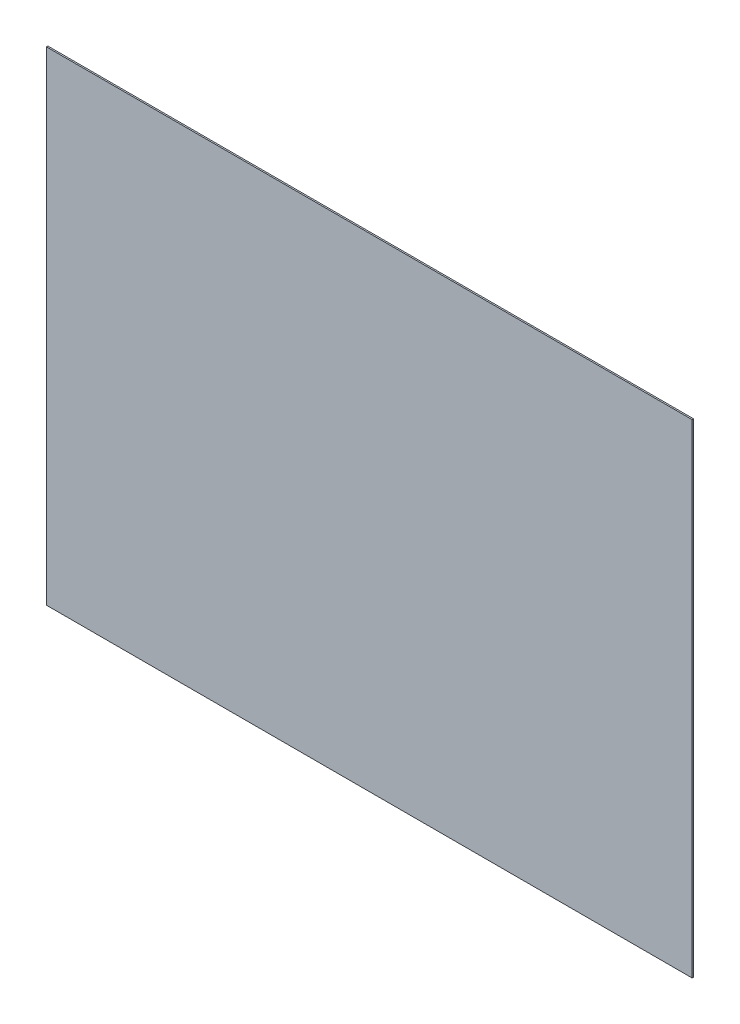
from build123d import *

# Parameters (mm, degrees)
SKETCH1_W           = 450
SKETCH1_H           = 337
BOSS_EXTRUDE1_DEPTH = 1


with BuildPart() as part:
    # Sketch1 → Boss-Extrude1 (new body)
    with BuildSketch(Plane.XY):
        Rectangle(SKETCH1_W, SKETCH1_H)
    extrude(amount=BOSS_EXTRUDE1_DEPTH)


solid = part.part
